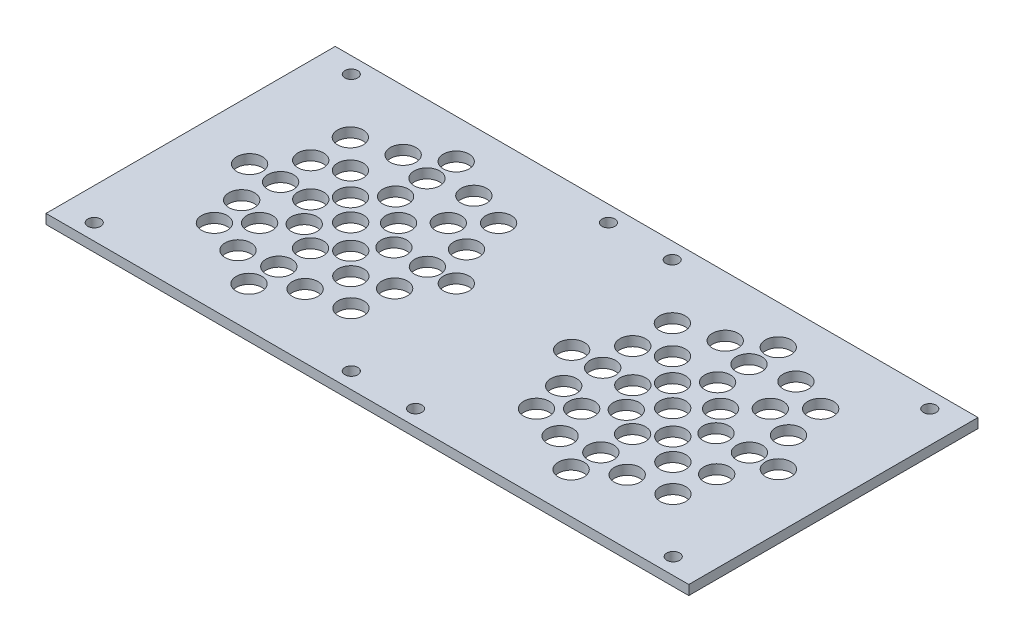
from build123d import *

# Parameters (mm, degrees)
SKETCH1_W           = 200
SKETCH1_H           = 90
BOSS_EXTRUDE1_DEPTH = 3
SKETCH2_R           = 2
SKETCH2_R_2         = 4
CUT_EXTRUDE1_DEPTH  = 3


with BuildPart() as part:
    # Sketch1 → Boss-Extrude1 (new body)
    with BuildSketch(Plane(origin=(0, 0, 0), x_dir=(1, 0, 0), z_dir=(0, 1, 0))):
        with Locations((6.810810811, 7.918918919)):
            Rectangle(SKETCH1_W, SKETCH1_H)
    extrude(amount=BOSS_EXTRUDE1_DEPTH)

    # Sketch2 → Cut-Extrude1 (cut)
    with BuildSketch(Plane(origin=(0, 3, 0), x_dir=(1, 0, 0), z_dir=(0, 1, 0))):
        with Locations(Location((-83.189189189, 47.918918919, 0), (0, 0, 270))):
            Circle(SKETCH2_R)
        with Locations(Location((-83.189189189, -32.081081081, 0), (0, 0, 270))):
            Circle(SKETCH2_R)
        with Locations(Location((-3.189189189, 47.918918919, 0), (0, 0, 270))):
            Circle(SKETCH2_R)
        with Locations(Location((-3.189189189, -32.081081081, 0), (0, 0, 270))):
            Circle(SKETCH2_R)
        with Locations(Location((96.97523931, 47.753811706, 0), (0, 0, 270))):
            Circle(SKETCH2_R)
        with Locations(Location((96.890661701, -31.999841307, 0), (0, 0, 270))):
            Circle(SKETCH2_R)
        with Locations(Location((16.73095992, 47.837679145, 0), (0, 0, 270))):
            Circle(SKETCH2_R)
        with Locations(Location((16.92956487, -32.199971625, 0), (0, 0, 270))):
            Circle(SKETCH2_R)
        with Locations(Location((64.409536285, 15.225493569, 0), (0, 0, 270))):
            Circle(SKETCH2_R_2)
        with Locations(Location((64.458960542, 0.301508961, 0), (0, 0, 270))):
            Circle(SKETCH2_R_2)
        with Locations(Location((72.150575188, 22.957645887, 0), (0, 0, 270))):
            Circle(SKETCH2_R_2)
        with Locations(Location((79.984903702, 30.782980722, 0), (0, 0, 270))):
            Circle(SKETCH2_R_2)
        with Locations(Location((42.782150533, -6.377064303, 0), (0, 0, 270))):
            Circle(SKETCH2_R_2)
        with Locations(Location((35.744744462, -13.406391548, 0), (0, 0, 270))):
            Circle(SKETCH2_R_2)
        with Locations(Location((50.031602385, 0.251885254, 0), (0, 0, 270))):
            Circle(SKETCH2_R_2)
        with Locations(Location((71.328743505, -6.540662674, 0), (0, 0, 270))):
            Circle(SKETCH2_R_2)
        with Locations(Location((56.810810811, 7.918918919, 0), (0, 0, 270))):
            Circle(SKETCH2_R_2)
        with Locations(Location((79.984903702, -15.162031659, 0), (0, 0, 270))):
            Circle(SKETCH2_R_2)
        with Locations(Location((50.031602385, 14.670880058, 0), (0, 0, 270))):
            Circle(SKETCH2_R_2)
        with Locations(Location((42.782150533, 21.891194601, 0), (0, 0, 270))):
            Circle(SKETCH2_R_2)
        with Locations(Location((33.854481941, 30.782980722, 0), (0, 0, 270))):
            Circle(SKETCH2_R_2)
        with Locations(Location((70.286929504, 7.918918919, 0), (0, 0, 270))):
            Circle(SKETCH2_R_2)
        with Locations(Location((80.695917052, 7.918918919, 0), (0, 0, 270))):
            Circle(SKETCH2_R_2)
        with Locations(Location((89.69828466, 7.918918919, 0), (0, 0, 270))):
            Circle(SKETCH2_R_2)
        with Locations(Location((35.027656371, 7.918918919, 0), (0, 0, 270))):
            Circle(SKETCH2_R_2)
        with Locations(Location((44.40512263, 7.918918919, 0), (0, 0, 270))):
            Circle(SKETCH2_R_2)
        with Locations(Location((25.368866125, 7.918918919, 0), (0, 0, 270))):
            Circle(SKETCH2_R_2)
        with Locations(Location((57.533575392, -5.280819839, 0), (0, 0, 270))):
            Circle(SKETCH2_R_2)
        with Locations(Location((57.533575392, -15.162031659, 0), (0, 0, 270))):
            Circle(SKETCH2_R_2)
        with Locations(Location((57.533575392, -24.410851007, 0), (0, 0, 270))):
            Circle(SKETCH2_R_2)
        with Locations(Location((56.810810811, 21.891194601, 0), (0, 0, 270))):
            Circle(SKETCH2_R_2)
        with Locations(Location((56.810810811, 31.666397221, 0), (0, 0, 270))):
            Circle(SKETCH2_R_2)
        with Locations(Location((56.810810811, 40.762539492, 0), (0, 0, 270))):
            Circle(SKETCH2_R_2)
        with Locations(Location((33.854481941, 18.444169796, 0), (0, 0, 270))):
            Circle(SKETCH2_R_2)
        with Locations(Location((46.782150533, 34.292087773, 0), (0, 0, 270))):
            Circle(SKETCH2_R_2)
        with Locations(Location((68.786534903, 34.292087773, 0), (0, 0, 270))):
            Circle(SKETCH2_R_2)
        with Locations(Location((82.102536991, 18.670880058, 0), (0, 0, 270))):
            Circle(SKETCH2_R_2)
        with Locations(Location((81.446114352, -3.030227937, 0), (0, 0, 270))):
            Circle(SKETCH2_R_2)
        with Locations(Location((67.661238952, -17.096427325, 0), (0, 0, 270))):
            Circle(SKETCH2_R_2)
        with Locations(Location((46.782150533, -17.096427325, 0), (0, 0, 270))):
            Circle(SKETCH2_R_2)
        with Locations(Location((33.854481941, -3.030227937, 0), (0, 0, 270))):
            Circle(SKETCH2_R_2)
        with Locations(Location((-35.761406417, 15.18771879, 0), (0, 0, 270))):
            Circle(SKETCH2_R_2)
        with Locations(Location((-35.71198216, 0.263734182, 0), (0, 0, 270))):
            Circle(SKETCH2_R_2)
        with Locations(Location((-28.020367515, 22.919871108, 0), (0, 0, 270))):
            Circle(SKETCH2_R_2)
        with Locations(Location((-20.186039001, 30.745205943, 0), (0, 0, 270))):
            Circle(SKETCH2_R_2)
        with Locations(Location((-57.388792169, -6.414839082, 0), (0, 0, 270))):
            Circle(SKETCH2_R_2)
        with Locations(Location((-64.42619824, -13.444166327, 0), (0, 0, 270))):
            Circle(SKETCH2_R_2)
        with Locations(Location((-50.139340317, 0.214110475, 0), (0, 0, 270))):
            Circle(SKETCH2_R_2)
        with Locations(Location((-28.842199198, -6.578437453, 0), (0, 0, 270))):
            Circle(SKETCH2_R_2)
        with Locations(Location((-43.360131891, 7.88114414, 0), (0, 0, 270))):
            Circle(SKETCH2_R_2)
        with Locations(Location((-20.186039001, -15.199806438, 0), (0, 0, 270))):
            Circle(SKETCH2_R_2)
        with Locations(Location((-50.139340317, 14.633105278, 0), (0, 0, 270))):
            Circle(SKETCH2_R_2)
        with Locations(Location((-57.388792169, 21.853419822, 0), (0, 0, 270))):
            Circle(SKETCH2_R_2)
        with Locations(Location((-66.316460761, 30.745205943, 0), (0, 0, 270))):
            Circle(SKETCH2_R_2)
        with Locations(Location((-29.884013198, 7.88114414, 0), (0, 0, 270))):
            Circle(SKETCH2_R_2)
        with Locations(Location((-19.475025651, 7.88114414, 0), (0, 0, 270))):
            Circle(SKETCH2_R_2)
        with Locations(Location((-10.472658042, 7.88114414, 0), (0, 0, 270))):
            Circle(SKETCH2_R_2)
        with Locations(Location((-65.143286331, 7.88114414, 0), (0, 0, 270))):
            Circle(SKETCH2_R_2)
        with Locations(Location((-55.765820072, 7.88114414, 0), (0, 0, 270))):
            Circle(SKETCH2_R_2)
        with Locations(Location((-74.802076578, 7.88114414, 0), (0, 0, 270))):
            Circle(SKETCH2_R_2)
        with Locations(Location((-42.63736731, -5.318594618, 0), (0, 0, 270))):
            Circle(SKETCH2_R_2)
        with Locations(Location((-42.63736731, -15.199806438, 0), (0, 0, 270))):
            Circle(SKETCH2_R_2)
        with Locations(Location((-42.63736731, -24.448625786, 0), (0, 0, 270))):
            Circle(SKETCH2_R_2)
        with Locations(Location((-43.360131891, 21.853419822, 0), (0, 0, 270))):
            Circle(SKETCH2_R_2)
        with Locations(Location((-43.360131891, 31.628622442, 0), (0, 0, 270))):
            Circle(SKETCH2_R_2)
        with Locations(Location((-43.360131891, 40.724764713, 0), (0, 0, 270))):
            Circle(SKETCH2_R_2)
        with Locations(Location((-66.316460761, 18.406395017, 0), (0, 0, 270))):
            Circle(SKETCH2_R_2)
        with Locations(Location((-53.388792169, 34.254312994, 0), (0, 0, 270))):
            Circle(SKETCH2_R_2)
        with Locations(Location((-31.384407799, 34.254312994, 0), (0, 0, 270))):
            Circle(SKETCH2_R_2)
        with Locations(Location((-18.068405712, 18.633105278, 0), (0, 0, 270))):
            Circle(SKETCH2_R_2)
        with Locations(Location((-18.72482835, -3.068002716, 0), (0, 0, 270))):
            Circle(SKETCH2_R_2)
        with Locations(Location((-32.50970375, -17.134202104, 0), (0, 0, 270))):
            Circle(SKETCH2_R_2)
        with Locations(Location((-53.388792169, -17.134202104, 0), (0, 0, 270))):
            Circle(SKETCH2_R_2)
        with Locations(Location((-66.316460761, -3.068002716, 0), (0, 0, 270))):
            Circle(SKETCH2_R_2)
    extrude(amount=-CUT_EXTRUDE1_DEPTH, mode=Mode.SUBTRACT)


solid = part.part
